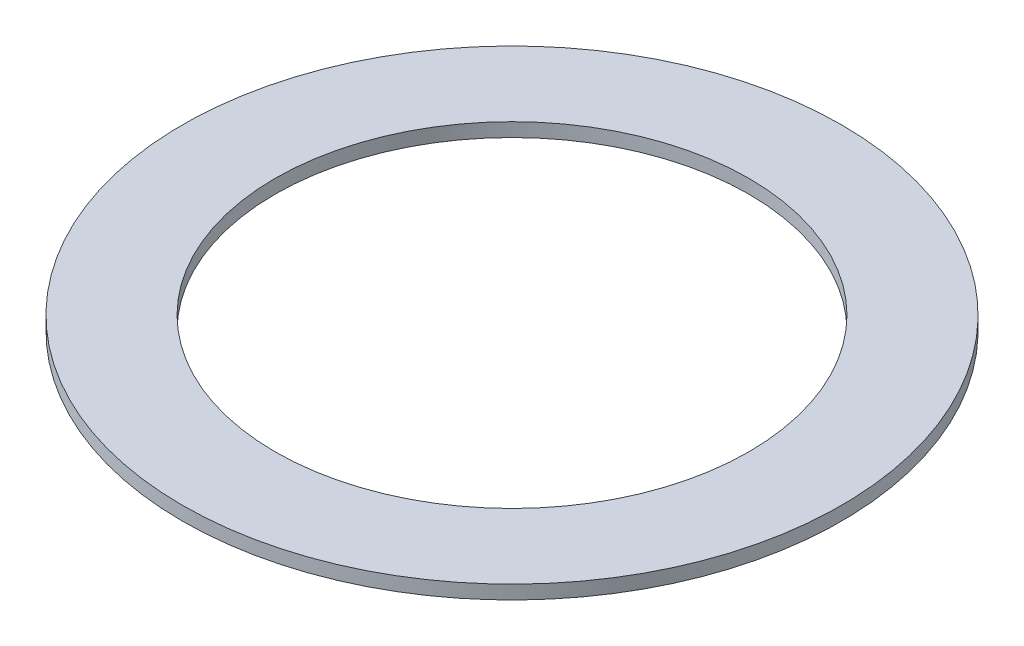
from build123d import *

# Parameters (mm, degrees)
SKETCH1_R           = 12
SKETCH1_R_2         = 8.625
BOSS_EXTRUDE1_DEPTH = 0.5


with BuildPart() as part:
    # Sketch1 → Boss-Extrude1 (new body)
    with BuildSketch(Plane(origin=(0, 0, 0), x_dir=(1, 0, 0), z_dir=(0, 1, 0))):
        with Locations(Location((0, 0, 0), (0, 0, 270))):
            Circle(SKETCH1_R)
        with Locations(Location((0, 0, 0), (0, 0, 270))):
            Circle(SKETCH1_R_2, mode=Mode.SUBTRACT)
    extrude(amount=BOSS_EXTRUDE1_DEPTH)


solid = part.part
